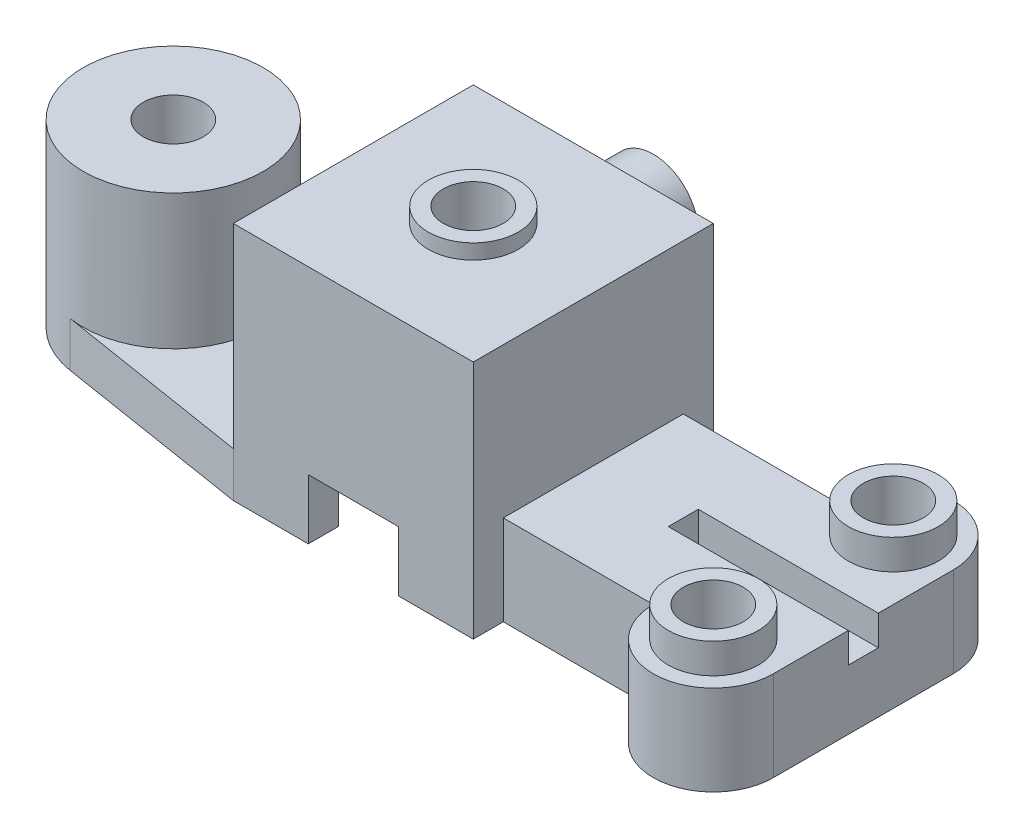
from build123d import *

# Parameters (mm, degrees)
SKETCH1_W               = 80
SKETCH1_H               = 80
BOSS_EXTRUDE1_DEPTH     = 80
CUT_EXTRUDE1_DEPTH      = 98.979589711
CUT_EXTRUDE1_DEPTH_BACK = 70
SKETCH2_W               = 60
SKETCH2_H               = 60
SKETCH3_R               = 15
SKETCH3_R_2             = 10
BOSS_EXTRUDE2_DEPTH     = 5
BOSS_EXTRUDE3_DEPTH     = 30
SKETCH5_R               = 15
BOSS_EXTRUDE4_DEPTH     = 10
HOLE1_D                 = 10
HOLE1_CBORE_D           = 20
HOLE1_CBORE_DEPTH       = 15
SKETCH8_W               = 60
SKETCH8_H               = 10
CUT_EXTRUDE2_DEPTH      = 10
SKETCH9_R               = 30
BOSS_EXTRUDE5_DEPTH     = 60
BOSS_EXTRUDE6_DEPTH     = 15
SKETCH11_W              = 30
SKETCH11_H              = 20
CUT_EXTRUDE3_DEPTH      = 180.51323071
SKETCH12_R              = 15
BOSS_EXTRUDE7_DEPTH     = 20
HOLE2_D                 = 20
HOLE3_D                 = 20
HOLE3_DEPTH             = 30
HOLE4_D                 = 20


with BuildPart() as part:
    # Sketch1 → Boss-Extrude1 (new body)
    with BuildSketch(Plane(origin=(0, 0, 0), x_dir=(1, 0, 0), z_dir=(0, 1, 0))):
        Rectangle(SKETCH1_W, SKETCH1_H)
    extrude(amount=BOSS_EXTRUDE1_DEPTH)

    # Sketch2 → Cut-Extrude1 (cut, two sides: drawn at the far end of the back side and taken through both)
    with BuildSketch(Plane.XZ.offset(-CUT_EXTRUDE1_DEPTH_BACK)):
        Rectangle(SKETCH2_W, SKETCH2_H)
    extrude(amount=CUT_EXTRUDE1_DEPTH + CUT_EXTRUDE1_DEPTH_BACK, mode=Mode.SUBTRACT)

    # Sketch3 → Boss-Extrude2 (add)
    with BuildSketch(Plane(origin=(0, 80, 0), x_dir=(1, 0, 0), z_dir=(0, 1, 0))):
        with Locations(Location((0, 0, 0), (0, 0, 270))):
            Circle(SKETCH3_R)
        with Locations(Location((0, 0, 0), (0, 0, 270))):
            Circle(SKETCH3_R_2, mode=Mode.SUBTRACT)
    extrude(amount=BOSS_EXTRUDE2_DEPTH)

    # Sketch4 → Boss-Extrude3 (add)
    with BuildSketch(Plane(origin=(0, 0, 0), x_dir=(1, 0, 0), z_dir=(0, 1, 0))):
        with BuildLine():
            Line((40, 30), (90, 30))
            ThreePointArc((90, 30), (110, 50), (130, 30))
            Line((130, 30), (130, -30))
            ThreePointArc((130, -30), (110, -50), (90, -30))
            Line((90, -30), (40, -30))
            Line((40, -30), (40, 30))
        make_face()
    extrude(amount=BOSS_EXTRUDE3_DEPTH)

    # Sketch5 → Boss-Extrude4 (add)
    with BuildSketch(Plane(origin=(0, 30, 0), x_dir=(1, 0, 0), z_dir=(0, 1, 0))):
        with Locations(Location((110, 30, 0), (0, 0, 270))):
            Circle(SKETCH5_R)
        with Locations(Location((110, -30, 0), (0, 0, 270))):
            Circle(SKETCH5_R)
    extrude(amount=BOSS_EXTRUDE4_DEPTH)

    # Hole1 (through all)
    with Locations(Plane(origin=(0, 40, 0), x_dir=(1, 0, 0), z_dir=(0, 1, 0))):
        with Locations((110, 30), (110, -30)):
            CounterBoreHole(HOLE1_D / 2, HOLE1_CBORE_D / 2, HOLE1_CBORE_DEPTH)

    # Sketch8 → Cut-Extrude2 (cut)
    with BuildSketch(Plane(origin=(0, 30, 0), x_dir=(1, 0, 0), z_dir=(0, 1, 0))):
        with Locations((100, 0)):
            Rectangle(SKETCH8_W, SKETCH8_H)
    extrude(amount=-CUT_EXTRUDE2_DEPTH, mode=Mode.SUBTRACT)



with BuildPart() as body_2:
    # Sketch9 → Boss-Extrude5 (new body)
    with BuildSketch(Plane(origin=(0, 0, 0), x_dir=(1, 0, 0), z_dir=(0, 1, 0))):
        with Locations(Location((-100, 0, 0), (0, 0, 270))):
            Circle(SKETCH9_R)
    extrude(amount=BOSS_EXTRUDE5_DEPTH)


with BuildPart() as part_1:
    add(part.part)

    add(body_2.part)  # Boss-Extrude6 merges body 2
    # Sketch10 → Boss-Extrude6 (add)
    with BuildSketch(Plane(origin=(0, 0, 0), x_dir=(1, 0, 0), z_dir=(0, 1, 0))):
        with BuildLine():
            Line((-40, 40), (-40, -40))
            Line((-40, -40), (-104.747935056, -29.621902584))
            ThreePointArc((-104.747935056, -29.621902584), (-70, 0), (-104.747935056, 29.621902584))
            Line((-104.747935056, 29.621902584), (-40, 40))
        make_face()
    extrude(amount=BOSS_EXTRUDE6_DEPTH)

    # Sketch11 → Cut-Extrude3 (cut, through all)
    with BuildSketch(Plane(origin=(0, 0, -40), x_dir=(-1, 0, 0), z_dir=(0, 0, -1))):
        with Locations((0, 10)):
            Rectangle(SKETCH11_W, SKETCH11_H)
    extrude(amount=-CUT_EXTRUDE3_DEPTH, mode=Mode.SUBTRACT)

    # Sketch12 → Boss-Extrude7 (add)
    with BuildSketch(Plane(origin=(0, 0, -40), x_dir=(-1, 0, 0), z_dir=(0, 0, -1))):
        with Locations(Location((0, 55, 0), (0, 0, 180))):
            Circle(SKETCH12_R)
    extrude(amount=BOSS_EXTRUDE7_DEPTH)

    # Hole2 (through all)
    with Locations(Plane(origin=(0, 80, 0), x_dir=(1, 0, 0), z_dir=(0, 1, 0))):
        with Locations((0, 0)):
            Hole(HOLE2_D / 2)

    # Hole3
    with Locations(Plane(origin=(0, 0, -60), x_dir=(-1, 0, 0), z_dir=(0, 0, -1))):
        with Locations((0, 55)):
            Hole(HOLE3_D / 2, depth=HOLE3_DEPTH)

    # Hole4 (through all)
    with Locations(Plane(origin=(0, 60, 0), x_dir=(1, 0, 0), z_dir=(0, 1, 0))):
        with Locations((-100, 0)):
            Hole(HOLE4_D / 2)


solid = part_1.part
